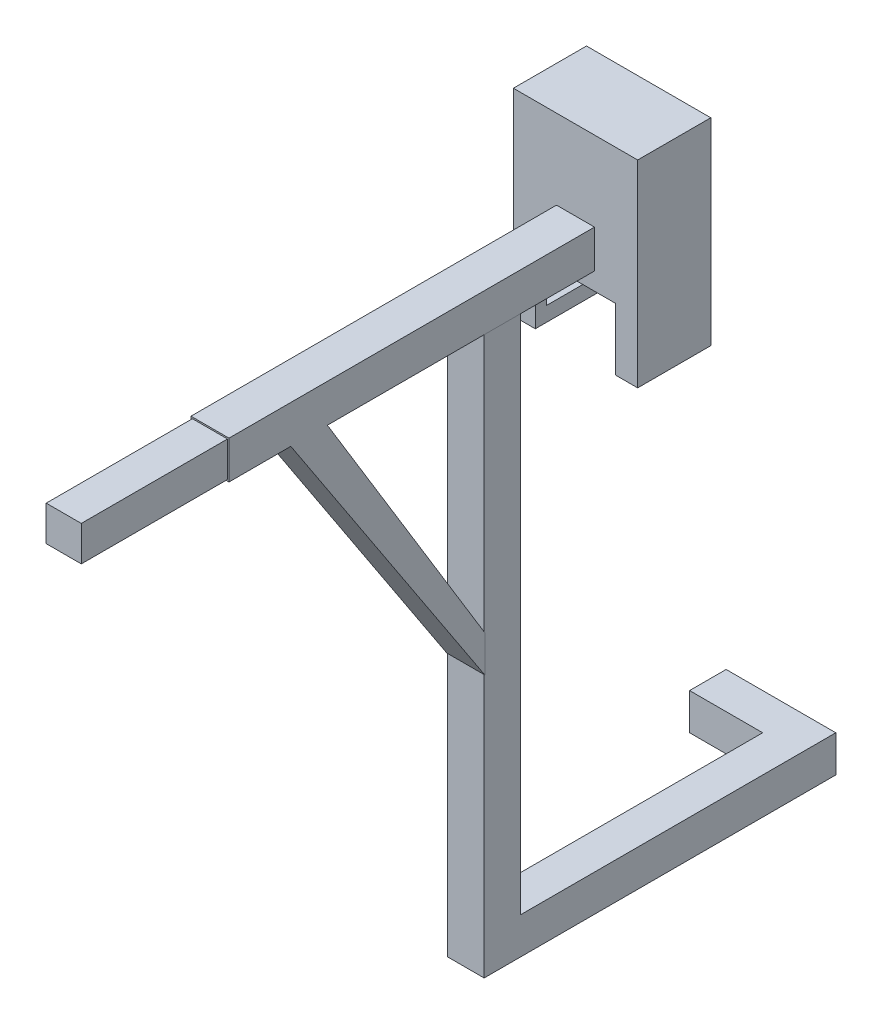
from build123d import *

# Parameters (mm, degrees)
SKETCH1_W           = 4.8
SKETCH1_H           = 4.8
BOSS_EXTRUDE1_DEPTH = 20
SKETCH2_W           = 5.2
SKETCH2_H           = 5.2
BOSS_EXTRUDE2_DEPTH = 50
SKETCH3_W           = 17
SKETCH3_H           = 27
BOSS_EXTRUDE3_DEPTH = 10
SKETCH4_W           = 13
SKETCH4_H           = 23
CUT_EXTRUDE1_DEPTH  = 8.5
SKETCH5_W           = 11
SKETCH5_H           = 8.5
CUT_EXTRUDE2_DEPTH  = 8.5
SKETCH6_W           = 5
SKETCH6_H           = 5
BOSS_EXTRUDE4_DEPTH = 81.5
SKETCH7_W           = 5
SKETCH7_H           = 5
BOSS_EXTRUDE5_DEPTH = 43.1
BOSS_EXTRUDE6_DEPTH = 5.2
SKETCH13_W          = 5
SKETCH13_H          = 5
BOSS_EXTRUDE7_DEPTH = 10


with BuildPart() as part:
    # Sketch1 → Boss-Extrude1 (new body)
    with BuildSketch(Plane.XY):
        with Locations((2.4, -2.4)):
            Rectangle(SKETCH1_W, SKETCH1_H)
    extrude(amount=BOSS_EXTRUDE1_DEPTH)

    # Sketch2 → Boss-Extrude2 (add)
    with BuildSketch(Plane(origin=(0, 0, 0), x_dir=(-1, 0, 0), z_dir=(0, 0, -1))):
        with Locations((-2.4, -2.4)):
            Rectangle(SKETCH2_W, SKETCH2_H)
    extrude(amount=BOSS_EXTRUDE2_DEPTH)

    # Sketch3 → Boss-Extrude3 (add)
    with BuildSketch(Plane(origin=(0, 0, -50), x_dir=(-1, 0, 0), z_dir=(0, 0, -1))):
        with Locations((-2.4, -2.4)):
            Rectangle(SKETCH3_W, SKETCH3_H)
    extrude(amount=BOSS_EXTRUDE3_DEPTH)

    # Sketch4 → Cut-Extrude1 (cut)
    with BuildSketch(Plane(origin=(0, 0, -60), x_dir=(-1, 0, 0), z_dir=(0, 0, -1))):
        with Locations((-2.4, -2.4)):
            Rectangle(SKETCH4_W, SKETCH4_H)
    extrude(amount=-CUT_EXTRUDE1_DEPTH, mode=Mode.SUBTRACT)

    # Sketch5 → Cut-Extrude2 (cut)
    with BuildSketch(Plane.XZ.offset(15.9)):
        with Locations((2.4, -54.25)):
            Rectangle(SKETCH5_W, SKETCH5_H)
    extrude(amount=-CUT_EXTRUDE2_DEPTH, mode=Mode.SUBTRACT)

    # Sketch6 → Boss-Extrude4 (add)
    with BuildSketch(Plane(origin=(0, 0.2, 0), x_dir=(1, 0, 0), z_dir=(0, 1, 0))):
        with Locations((2.4, 37.5)):
            Rectangle(SKETCH6_W, SKETCH6_H)
    extrude(amount=-BOSS_EXTRUDE4_DEPTH)

    # Sketch7 → Boss-Extrude5 (add)
    with BuildSketch(Plane(origin=(0, 0, -40), x_dir=(-1, 0, 0), z_dir=(0, 0, -1))):
        with Locations((-2.4, -78.8)):
            Rectangle(SKETCH7_W, SKETCH7_H)
    extrude(amount=BOSS_EXTRUDE5_DEPTH)

    # Sketch12 → Boss-Extrude6 (add)
    with BuildSketch(Plane(origin=(5, 0, 0), x_dir=(0, 0, -1), z_dir=(1, 0, 0))):
        Polygon((13.455782968, -5), (35, -40.359932103), (35, -45.359932103), (8.455782968, -5), align=None)
    extrude(amount=-BOSS_EXTRUDE6_DEPTH)

    # Sketch13 → Boss-Extrude7 (add)
    with BuildSketch(Plane.ZY.offset(0.1)):
        with Locations((-80.6, -78.8)):
            Rectangle(SKETCH13_W, SKETCH13_H)
    extrude(amount=BOSS_EXTRUDE7_DEPTH)


solid = part.part
